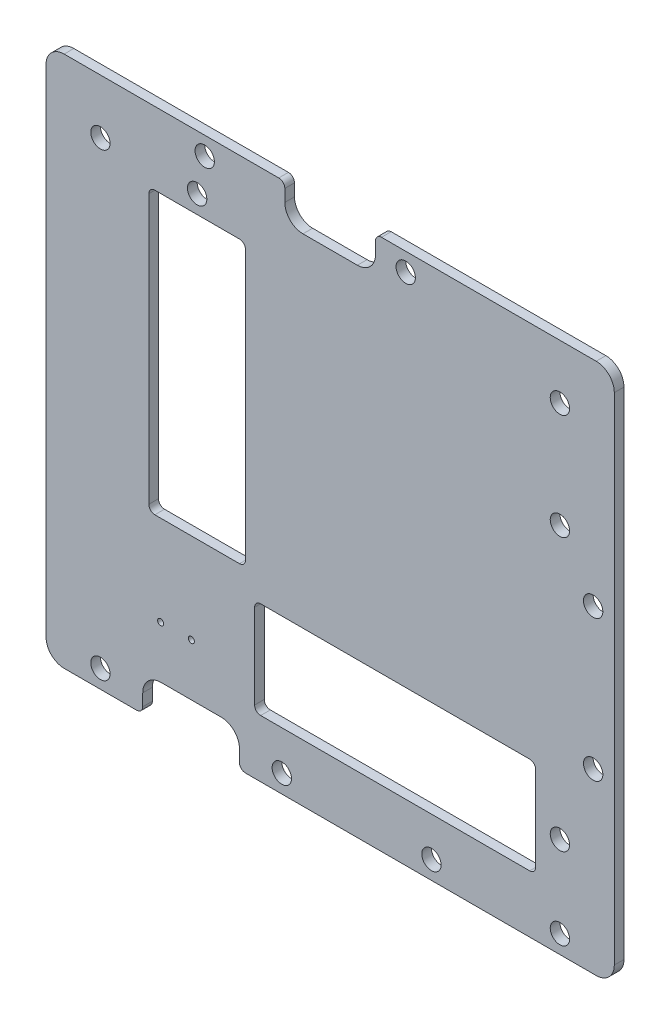
from build123d import *

# Parameters (mm, degrees)
SKETCH1_R                  = 0.5
SKETCH1_W                  = 46.5
SKETCH1_H                  = 16
SKETCH1_W_2                = 16
SKETCH1_H_2                = 46.5
BOSS_EXTRUDE1_DEPTH        = 1.6
F_3_2_3_2_DIAMETER_HOLE3_D = 3.2
FILLET1_R                  = 3
FILLET2_R                  = 1


with BuildPart() as part:
    # Sketch1 → Boss-Extrude1 (new body)
    with BuildSketch(Plane.XY):
        with BuildLine():
            Line((-87.56534388, 88.95185693), (-87.56534388, 6.95185693))
            ThreePointArc((-87.56534388, 6.95185693), (-86.686664224, 4.830536587), (-84.56534388, 3.95185693))
            Line((-84.56534388, 3.95185693), (-71.56534388, 3.95185693))
            Line((-71.56534388, 3.95185693), (-71.56534388, 9.95185693))
            Line((-71.56534388, 9.95185693), (-55.56534388, 9.95185693))
            Line((-55.56534388, 9.95185693), (-55.56534388, 3.95185693))
            Line((-55.56534388, 3.95185693), (3.43465612, 3.95185693))
            ThreePointArc((3.43465612, 3.95185693), (5.555976464, 4.830536587), (6.43465612, 6.95185693))
            Line((6.43465612, 6.95185693), (6.43465612, 88.95185693))
            ThreePointArc((6.43465612, 88.95185693), (5.555976464, 91.073177274), (3.43465612, 91.95185693))
            Line((3.43465612, 91.95185693), (-33.06534388, 91.95185693))
            Line((-33.06534388, 91.95185693), (-33.06534388, 85.95185693))
            Line((-33.06534388, 85.95185693), (-48.06534388, 85.95185693))
            Line((-48.06534388, 85.95185693), (-48.06534388, 91.95185693))
            Line((-48.06534388, 91.95185693), (-84.56534388, 91.95185693))
            ThreePointArc((-84.56534388, 91.95185693), (-86.686664224, 91.073177274), (-87.56534388, 88.95185693))
        make_face()
        with Locations((-63.52534388, 18.55185693)):
            Circle(SKETCH1_R, mode=Mode.SUBTRACT)
        with Locations((-68.60534388, 18.55185693)):
            Circle(SKETCH1_R, mode=Mode.SUBTRACT)
        with Locations((-29.81534388, 21.45185693)):
            Rectangle(SKETCH1_W, SKETCH1_H, mode=Mode.SUBTRACT)
        with Locations((-62.56534388, 56.70185693)):
            Rectangle(SKETCH1_W_2, SKETCH1_H_2, mode=Mode.SUBTRACT)
    extrude(amount=BOSS_EXTRUDE1_DEPTH)

    # Ø3.2 (3.2) Diameter Hole3 (through all)
    with Locations(Plane(origin=(0, 0, 0), x_dir=(-1, 0, 0), z_dir=(0, 0, -1))):
        with Locations((78.56534388, 6.95185693), (78.56534388, 82.95185693), (2.56534388, 82.95185693), (2.56534388, 6.95185693), (2.56534388, 65.45185693), (2.56534388, 20.45185693), (62.56534388, 82.95185693), (48.56534388, 6.95185693), (28.06534388, 88.95185693), (61.31534388, 88.95185693), (-2.93465612, 56.618523597), (-2.93465612, 33.285190263), (23.81534388, 6.95185693)):
            Hole(F_3_2_3_2_DIAMETER_HOLE3_D / 2)

    # Fillet1
    fillet1_edges = [part.edges().sort_by_distance(p)[0] for p in [
        (-48.06534388, 85.95185693, 0.8),
        (-33.06534388, 85.95185693, 0.8),
        (-55.56534388, 9.95185693, 0.8),
        (-71.56534388, 9.95185693, 0.8),
    ]]
    fillet(fillet1_edges, radius=FILLET1_R)

    # Fillet2
    fillet2_edges = [part.edges().sort_by_distance(p)[0] for p in [
        (-48.06534388, 91.95185693, 0.8),
        (-33.06534388, 91.95185693, 0.8),
        (-55.56534388, 3.95185693, 0.8),
        (-71.56534388, 3.95185693, 0.8),
        (-6.56534388, 13.45185693, 0.8),
        (-6.56534388, 29.45185693, 0.8),
        (-53.06534388, 29.45185693, 0.8),
        (-53.06534388, 13.45185693, 0.8),
        (-54.56534388, 33.45185693, 0.8),
        (-54.56534388, 79.95185693, 0.8),
        (-70.56534388, 79.95185693, 0.8),
        (-70.56534388, 33.45185693, 0.8),
    ]]
    fillet(fillet2_edges, radius=FILLET2_R)


solid = part.part
